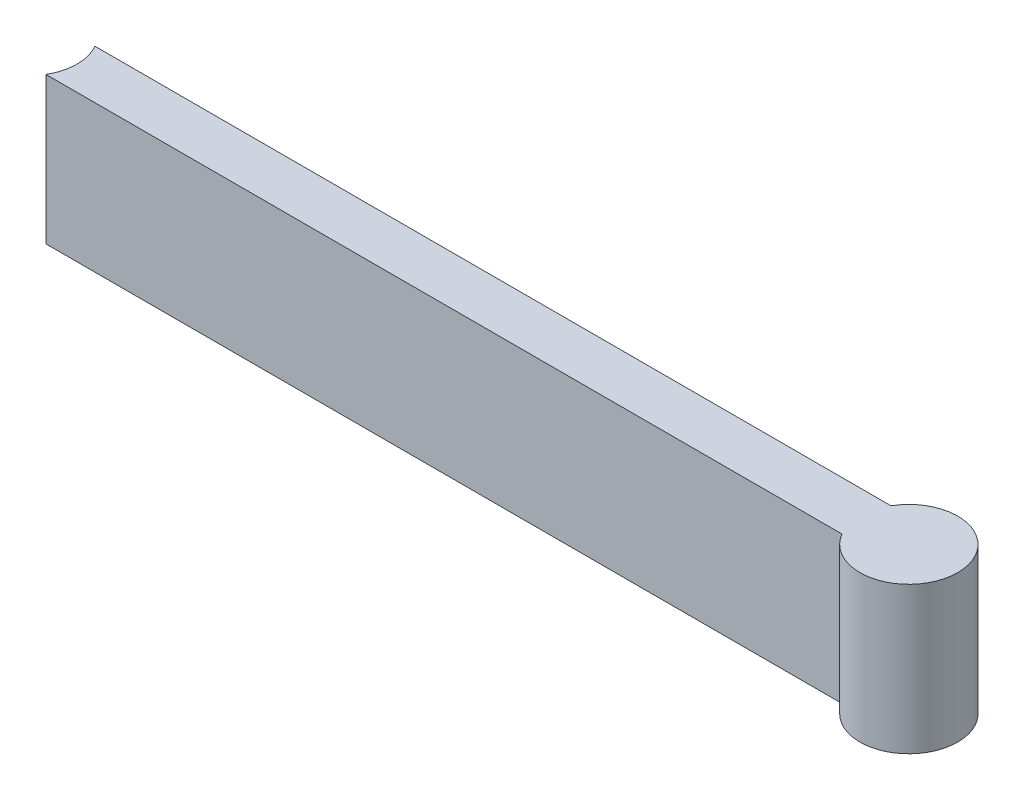
from build123d import *

# Parameters (mm, degrees)
BOSS_EXTRUDE1_DEPTH      = 75
BOSS_EXTRUDE1_DEPTH_BACK = 75


with BuildPart() as part:
    # Sketch1 → Boss-Extrude1 (new, two sides: drawn at the far end of the back side and taken through both)
    with BuildSketch(Plane(origin=(0, 0, 0), x_dir=(1, 0, 0), z_dir=(0, 1, 0)).offset(-BOSS_EXTRUDE1_DEPTH_BACK)):
        with BuildLine():
            Line((43.301270189, -25), (856.698729811, -25))
            ThreePointArc((856.698729811, -25), (950, 0), (856.698729811, 25))
            Line((856.698729811, 25), (43.301270189, 25))
            ThreePointArc((43.301270189, 25), (50, 0), (43.301270189, -25))
        make_face()
    extrude(amount=BOSS_EXTRUDE1_DEPTH + BOSS_EXTRUDE1_DEPTH_BACK)


solid = part.part
